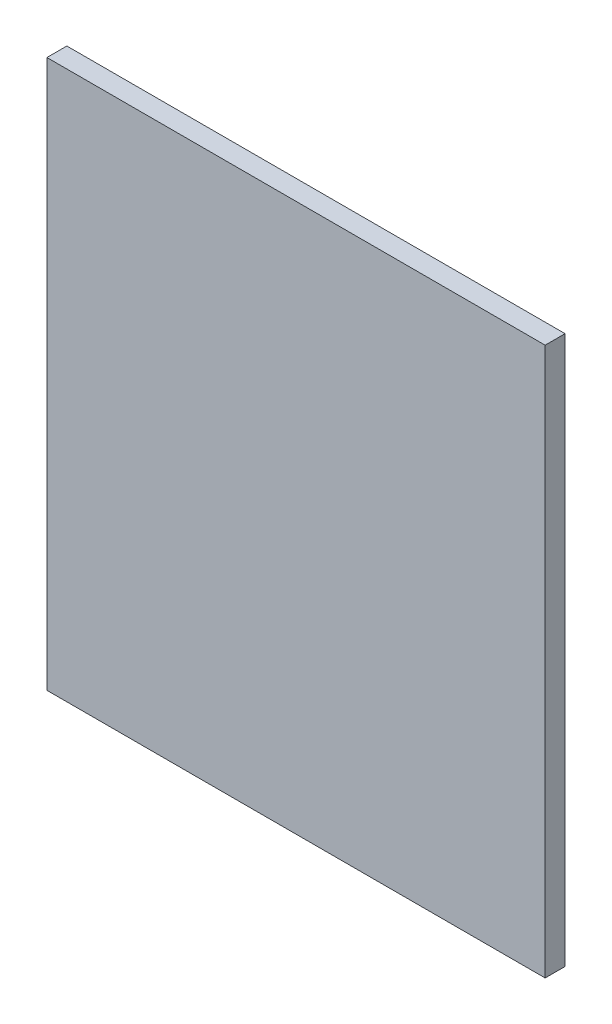
from build123d import *

# Parameters (mm, degrees)
SKETCH1_W     = 50
SKETCH1_H     = 55
PROFILE_DEPTH = 2


with BuildPart() as part:
    # Sketch1 → Profile (new body)
    with BuildSketch(Plane.XY):
        with Locations((25, 27.5)):
            Rectangle(SKETCH1_W, SKETCH1_H)
    extrude(amount=PROFILE_DEPTH)


solid = part.part
